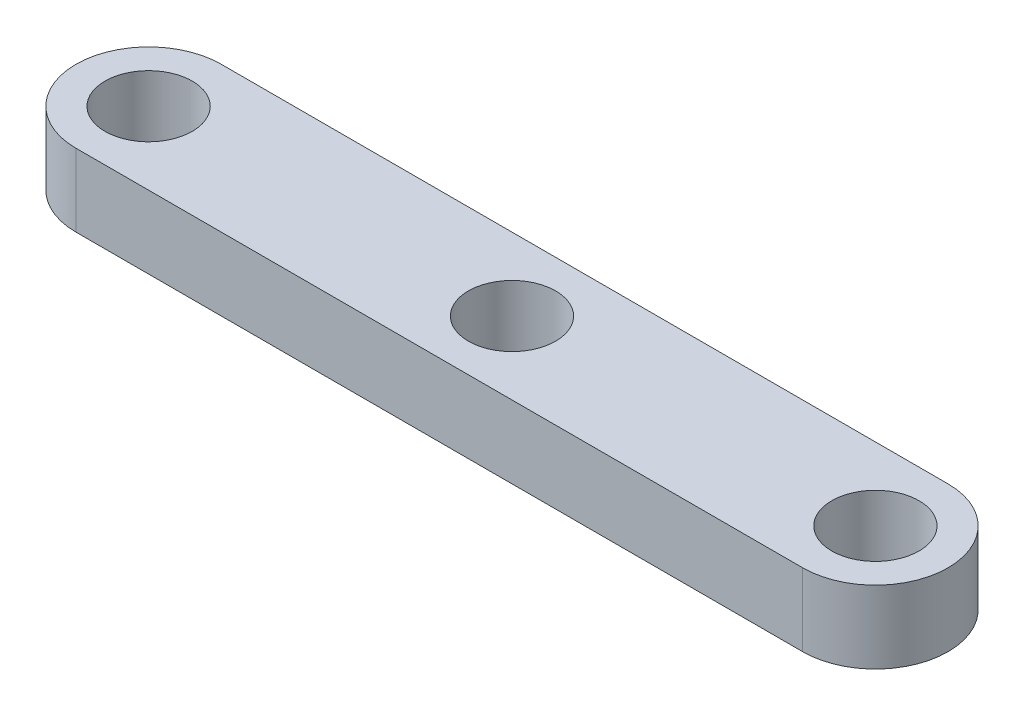
from build123d import *

# Parameters (mm, degrees)
SKETCH1_R           = 1.524
BOSS_EXTRUDE1_DEPTH = 2.54


with BuildPart() as part:
    # Sketch1 → Boss-Extrude1 (new body)
    with BuildSketch(Plane(origin=(0, 0, 0), x_dir=(1, 0, 0), z_dir=(0, 1, 0))):
        with BuildLine():
            Line((-12.7, 2.54), (12.7, 2.54))
            ThreePointArc((12.7, 2.54), (15.24, 0), (12.7, -2.54))
            Line((12.7, -2.54), (-12.7, -2.54))
            ThreePointArc((-12.7, -2.54), (-15.24, 0), (-12.7, 2.54))
        make_face()
        with Locations(Location((0, 0, 0), (0, 0, 270))):
            Circle(SKETCH1_R, mode=Mode.SUBTRACT)
        with Locations(Location((-12.7, 0, 0), (0, 0, 270))):
            Circle(SKETCH1_R, mode=Mode.SUBTRACT)
        with Locations(Location((12.7, 0, 0), (0, 0, 270))):
            Circle(SKETCH1_R, mode=Mode.SUBTRACT)
    extrude(amount=BOSS_EXTRUDE1_DEPTH)


solid = part.part
